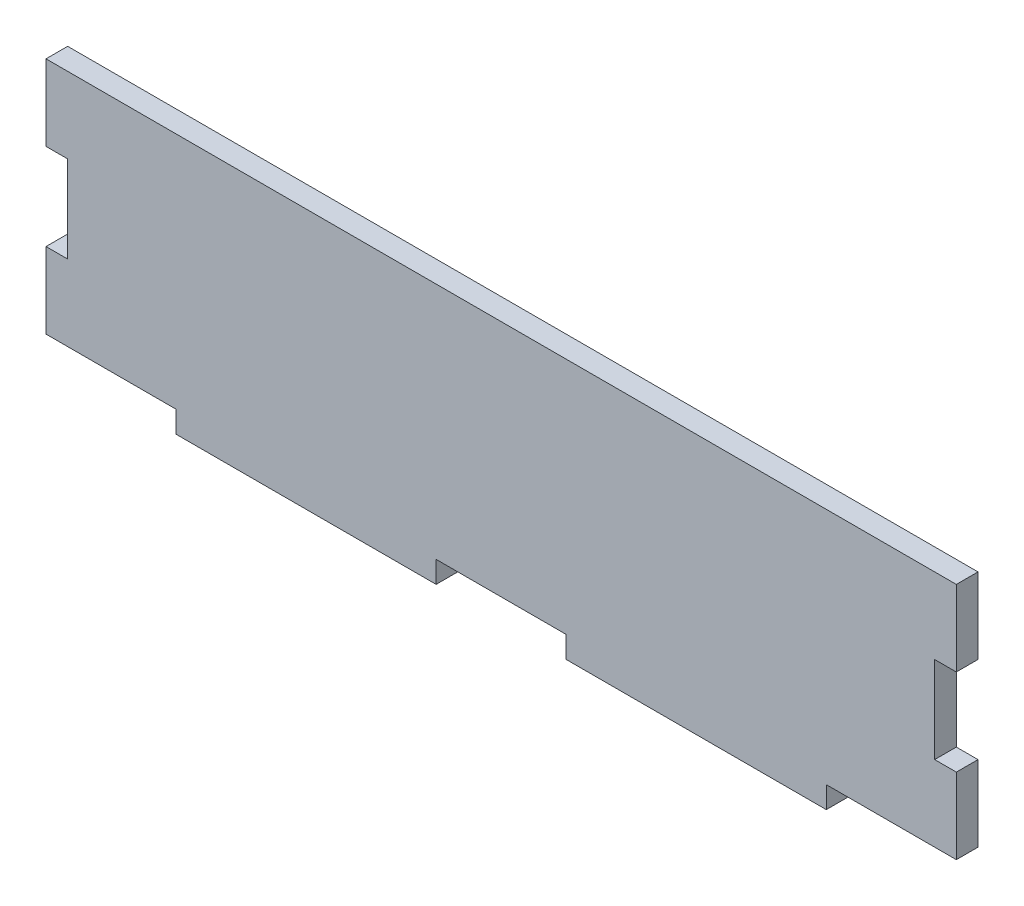
from build123d import *

# Parameters (mm, degrees)
BOSS_EXTRU_1_DEPTH = 5


with BuildPart() as part:
    # Esquisse1 → Boss.-Extru.1 (new body)
    with BuildSketch(Plane.XY):
        Polygon((-54.716297944, -171.04509165), (155.283702056, -171.04509165), (155.283702056, -188.54509165), (150.283702056, -188.54509165), (150.283702056, -208.54509165), (155.283702056, -208.54509165), (155.283702056, -226.04509165), (125.283702056, -226.04509165), (125.283702056, -231.04509165), (65.283702056, -231.04509165), (65.283702056, -226.04509165), (35.283702056, -226.04509165), (35.283702056, -231.04509165), (-24.716297944, -231.04509165), (-24.716297944, -226.04509165), (-54.716297944, -226.04509165), (-54.716297944, -208.54509165), (-49.716297944, -208.54509165), (-49.716297944, -188.54509165), (-54.716297944, -188.54509165), align=None)
    extrude(amount=BOSS_EXTRU_1_DEPTH)


solid = part.part
